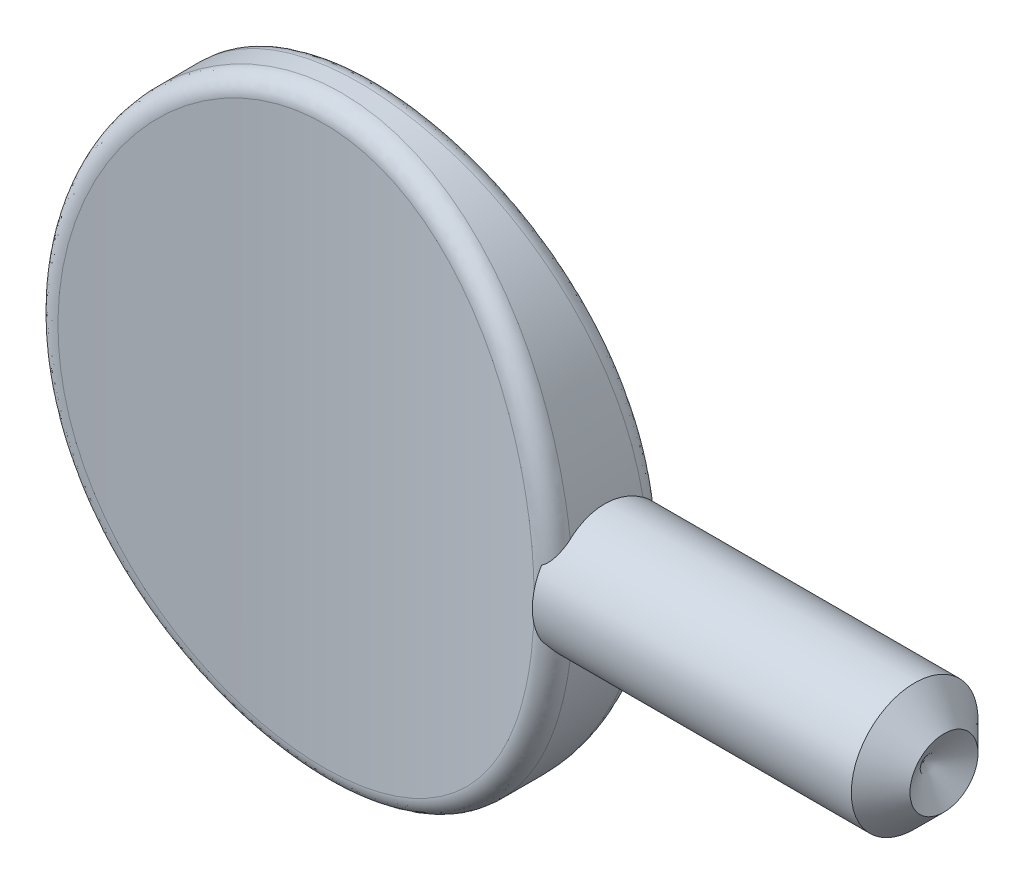
from build123d import *

# Parameters (mm, degrees)
SKETCH1_RX              = 11.303
SKETCH1_RY              = 9.906
EXTRUDE1_DEPTH          = 2.286
CUT_EXTRUDE1_DEPTH      = 16.202382741
CUT_EXTRUDE1_DEPTH_BACK = 16.202382741
SKETCH2_OUTSIDE_W       = 27.892
SKETCH2_OUTSIDE_H       = 12.652
FILLET3_R               = 0.677333333


with BuildPart() as part:
    # Sketch1 → Extrude1 (new, symmetric)
    with BuildSketch(Plane.XY):
        with Locations(Location((0, 0), (0, 0, -90))):
            Ellipse(SKETCH1_RX, SKETCH1_RY)
    extrude(amount=EXTRUDE1_DEPTH, both=True)

    # Sketch2 outside → Cut-Extrude1 (cut, two sides: drawn at the far end of the back side and taken through both)
    with BuildSketch(Plane(origin=(0, 0, 0), x_dir=(1, 0, 0), z_dir=(0, 1, 0)).offset(-CUT_EXTRUDE1_DEPTH_BACK)):
        Rectangle(SKETCH2_OUTSIDE_W, SKETCH2_OUTSIDE_H)
        with BuildLine():
            Line((-9.906, 2.286), (-9.906, -2.286))
            ThreePointArc((-9.906, -2.286), (0, -1.016), (9.906, -2.286))
            Line((9.906, -2.286), (9.906, 2.286))
            ThreePointArc((9.906, 2.286), (0, 1.016), (-9.906, 2.286))
        make_face(mode=Mode.SUBTRACT)
    extrude(amount=CUT_EXTRUDE1_DEPTH + CUT_EXTRUDE1_DEPTH_BACK, mode=Mode.SUBTRACT)

    # Fillet3
    fillet3_edges = [part.edges().sort_by_distance(p)[0] for p in [
        (-7.228513924, -7.728494619, 1.687044844),
        (3.75e-07, 11.303, -1.016),
    ]]
    fillet(fillet3_edges, radius=FILLET3_R)

    # Sketch3 → Revolve1 (revolve)
    with BuildSketch(Plane(origin=(0, 0, 0), x_dir=(1, 0, 0), z_dir=(0, 1, 0))):
        with BuildLine():
            Line((21.4884, 2.413), (22.606, 1.2954))
            Line((22.606, 1.2954), (21.827645154, 0))
            Line((21.827645154, 0), (9.072182281, 0))
            Line((9.072182281, 0), (9.072182281, 2.078343579))
            ThreePointArc((9.072182281, 2.078343579), (9.262571156, 2.199720149), (9.336678517, 2.413))
            Line((9.336678517, 2.413), (13.208, 2.413))
            Line((13.208, 2.413), (21.4884, 2.413))
        make_face()
    revolve(axis=Axis((0, 0, 0), (1, 0, 0)))


solid = part.part
